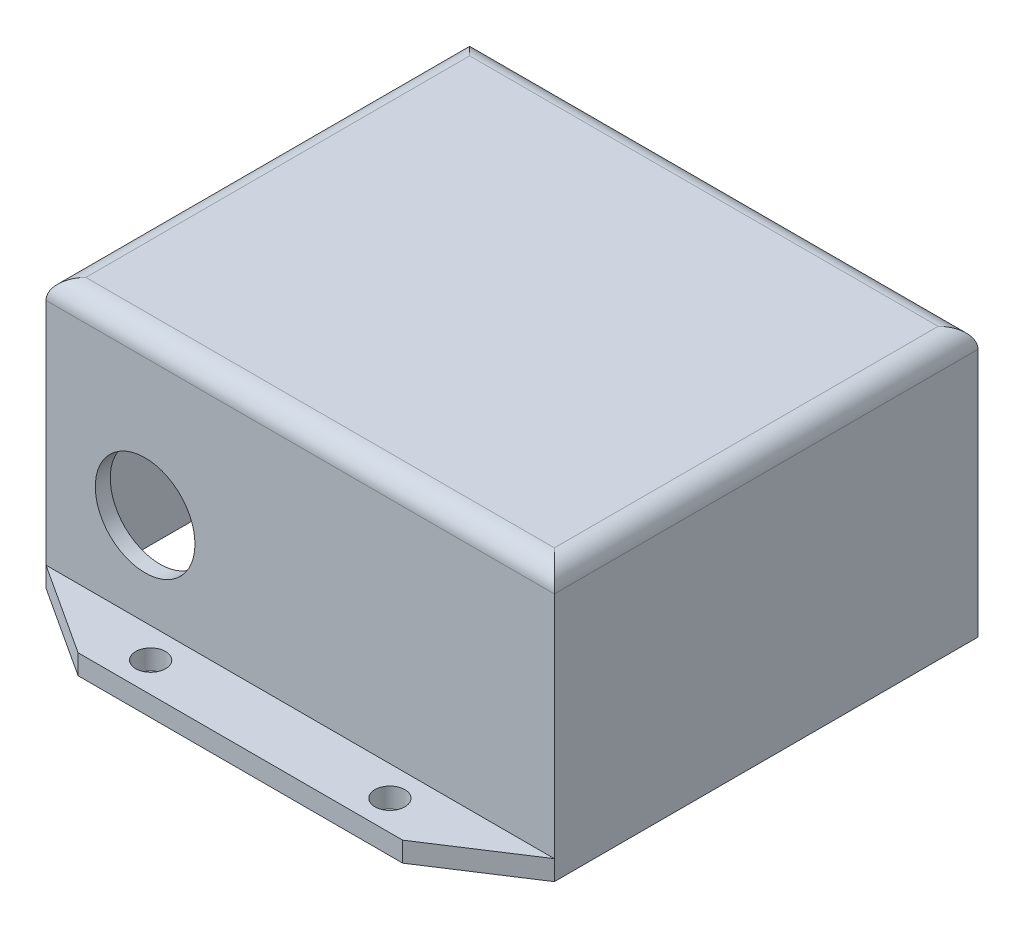
from build123d import *

# Parameters (mm, degrees)
SKETCH_1_R          = 3
EXTRUDE_1_DEPTH     = 4
SKETCH_2_W          = 102
SKETCH_2_H          = 85
EXTRUDE_2_DEPTH     = 50
SKETCH_4_W          = 96
SKETCH_4_H          = 79
CUT_EXTRUDE_3_DEPTH = 50
FILLET_1_R          = 4
CUT_EXTRUDE_4_REACH = 124.172
SKETCH_5_R          = 10


with BuildPart() as part:
    # 草图1 → 凸台-拉伸1 (new body)
    with BuildSketch(Plane(origin=(0, 0, 0), x_dir=(1, 0, 0), z_dir=(0, 1, 0))):
        Polygon((51, -42.5), (51, 42.5), (32.560911085, 54.5), (-32.560911085, 54.5), (-51, 42.5), (-51, -42.5), (-32.560911085, -54.5), (32.560911085, -54.5), align=None)
        with Locations(Location((-24, 48.5, 0), (0, 0, 270))):
            Circle(SKETCH_1_R, mode=Mode.SUBTRACT)
        with Locations(Location((24, 48.5, 0), (0, 0, 270))):
            Circle(SKETCH_1_R, mode=Mode.SUBTRACT)
        with Locations(Location((24, -48.5, 0), (0, 0, 270))):
            Circle(SKETCH_1_R, mode=Mode.SUBTRACT)
        with Locations(Location((-24, -48.5, 0), (0, 0, 270))):
            Circle(SKETCH_1_R, mode=Mode.SUBTRACT)
    extrude(amount=EXTRUDE_1_DEPTH)

    # 草图2 → 凸台-拉伸2 (add)
    with BuildSketch(Plane(origin=(0, 4, 0), x_dir=(1, 0, 0), z_dir=(0, 1, 0))):
        Rectangle(SKETCH_2_W, SKETCH_2_H)
    extrude(amount=EXTRUDE_2_DEPTH)

    # 草图4 → 切除-拉伸3 (cut)
    with BuildSketch(Plane.XZ):
        Rectangle(SKETCH_4_W, SKETCH_4_H)
    extrude(amount=-CUT_EXTRUDE_3_DEPTH, mode=Mode.SUBTRACT)

    # 圆角1
    fillet_1_edges = [part.edges().sort_by_distance(p)[0] for p in [
        (51, 54, 0),
        (0, 54, -42.5),
        (-51, 54, 0),
        (0, 54, 42.5),
    ]]
    fillet(fillet_1_edges, radius=FILLET_1_R)

    # 草图5 → 切除-拉伸4 (cut, up to next)
    with BuildSketch(Plane.XY.offset(42.5), mode=Mode.PRIVATE) as cut_extrude_4_sk1:
        with Locations((-31.111235747, 22.5989242)):
            Circle(SKETCH_5_R)
    cut_extrude_4_tool1 = extrude(cut_extrude_4_sk1.sketch, amount=-CUT_EXTRUDE_4_REACH, mode=Mode.PRIVATE) & part.part
    add(cut_extrude_4_tool1.solids().sort_by_distance((-31.111236, 22.598924, 42.5))[0], mode=Mode.SUBTRACT)


solid = part.part
